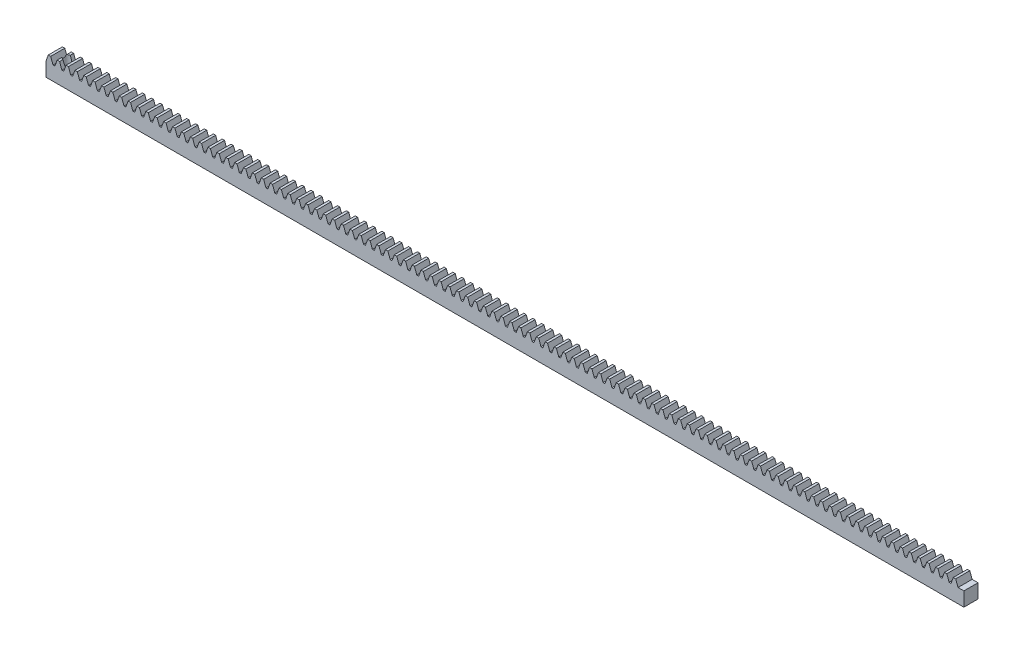
from build123d import *

# Parameters (mm, degrees)
SKETCH_1_W             = 650
SKETCH_1_H             = 10
EXTRUDE_1_DEPTH        = 10
EXTRUDE_2_DEPTH        = 10
PATTERN_LINEAR_1_COUNT = 103
PATTERN_LINEAR_1_PITCH = 6.283185307
CUT_EXTRUDE_1_REACH    = 652.239
SKETCH_3_R             = 2.6


with BuildPart() as part:
    # 草图1 → 拉伸1 (new body)
    with BuildSketch(Plane.XY):
        with Locations((325, -5)):
            Rectangle(SKETCH_1_W, SKETCH_1_H)
    extrude(amount=EXTRUDE_1_DEPTH)

    # 草图2 → 拉伸2 (add)
    with BuildSketch(Plane.XY.offset(10)):
        Polygon((0, 0), (1.637866054, 4.5), (3.323577771, 4.5), (4.961443825, 0), align=None)
    extrude_2 = extrude(amount=-EXTRUDE_2_DEPTH)

    # 阵列(线性)1: 拉伸2 ×103
    with Locations(*[(i * PATTERN_LINEAR_1_PITCH, 0, 0) for i in range(1, PATTERN_LINEAR_1_COUNT)]):
        add(extrude_2)

    # 草图3 → 切除-拉伸1 (cut, up to next)
    with BuildSketch(Plane.XZ.offset(10), mode=Mode.PRIVATE) as cut_extrude_1_sk1:
        with Locations(Location((10, 5, 0), (0, 0, 270))):
            Circle(SKETCH_3_R)
    cut_extrude_1_tool1 = extrude(cut_extrude_1_sk1.sketch, amount=-CUT_EXTRUDE_1_REACH, mode=Mode.PRIVATE) & part.part
    add(cut_extrude_1_tool1.solids().sort_by_distance((10, -10, 5))[0], mode=Mode.SUBTRACT)


solid = part.part
